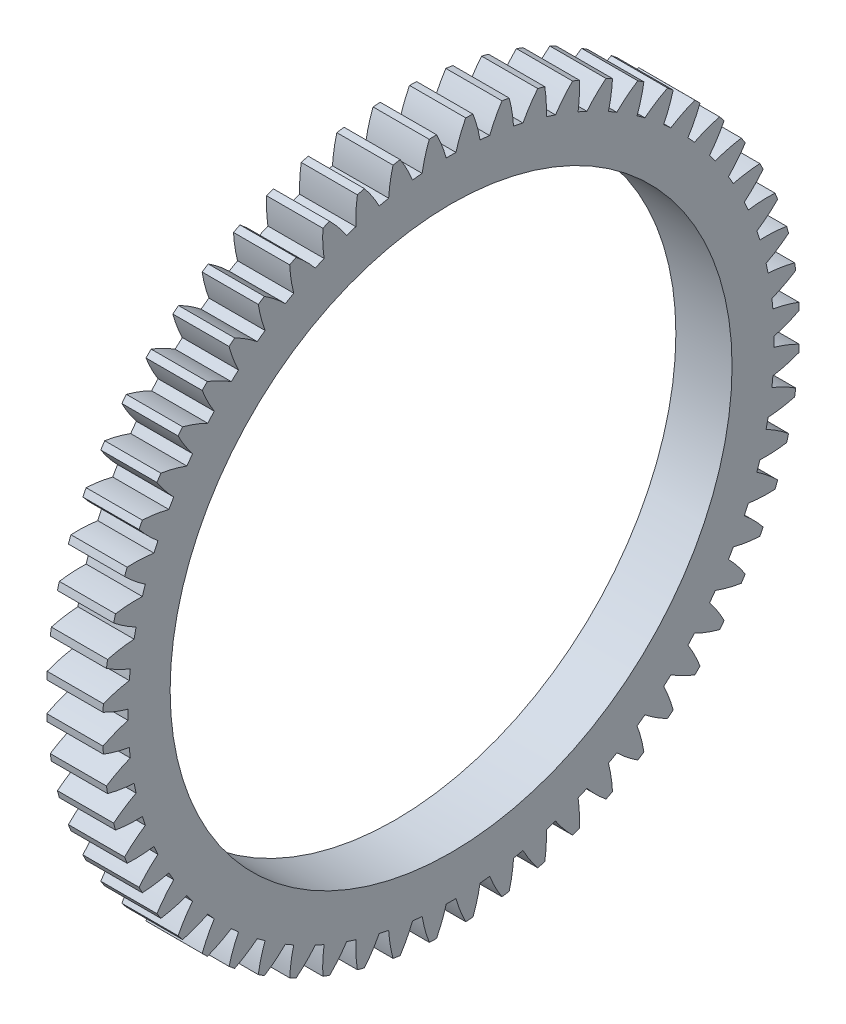
from build123d import *

# Parameters (mm, degrees)
BASPROSKE_W     = 5
BASPROSKE_H     = 31
TOOTHCUT_DEPTH  = 45.124822946
TEETHCUTS_COUNT = 60
TEETHCUTS_ANGLE = 354
BORSKE_R        = 25
BORE_DEPTH      = 50.0000508


with BuildPart() as part:
    # BasProSke → Base-Revolve (revolve)
    with BuildSketch(Plane(origin=(0, 0, 0), x_dir=(1, 0, 0), z_dir=(0, 1, 0)), mode=Mode.PRIVATE) as base_revolve_sk:
        with Locations((2.5, 15.5)):
            Rectangle(BASPROSKE_W, BASPROSKE_H)
    revolve(base_revolve_sk.sketch.rotate(Axis((-10, 0, 0), (1, 0, 0)), 180), axis=Axis((-10, 0, 0), (1, 0, 0)))

    # TooCutSke → ToothCut (cut, through all)
    with BuildSketch(Plane(origin=(0, 0, 0), x_dir=(0, 0, -1), z_dir=(1, 0, 0))):
        with BuildLine():
            ThreePointArc((0.430151971, 28.745781782), (0, 28.749), (-0.430151971, 28.745781782))
            ThreePointArc((-0.430151971, 28.745781782), (-0.81454129, 29.893990802), (-1.312684569, 30.997617721))
            ThreePointArc((-1.312684569, 30.997617721), (0, 31.0254), (1.312684569, 30.997617721))
            ThreePointArc((1.312684569, 30.997617721), (0.81454129, 29.893990802), (0.430151971, 28.745781782))
        make_face()
    toothcut = extrude(amount=TOOTHCUT_DEPTH, mode=Mode.SUBTRACT)

    # TeethCuts: ToothCut ×60 about axis
    teethcuts_axis = Axis((-10, 0, 0), (1, 0, 0))
    for i in range(1, TEETHCUTS_COUNT):
        add(toothcut.rotate(teethcuts_axis, i * TEETHCUTS_ANGLE / (TEETHCUTS_COUNT - 1)), mode=Mode.SUBTRACT)

    # BorSke → Bore (cut, symmetric)
    with BuildSketch(Plane(origin=(0, 0, 0), x_dir=(0, 0, -1), z_dir=(1, 0, 0))):
        with Locations(Location((0, 0, 0), (0, 0, 180))):
            Circle(BORSKE_R)
    extrude(amount=BORE_DEPTH, both=True, mode=Mode.SUBTRACT)


solid = part.part
